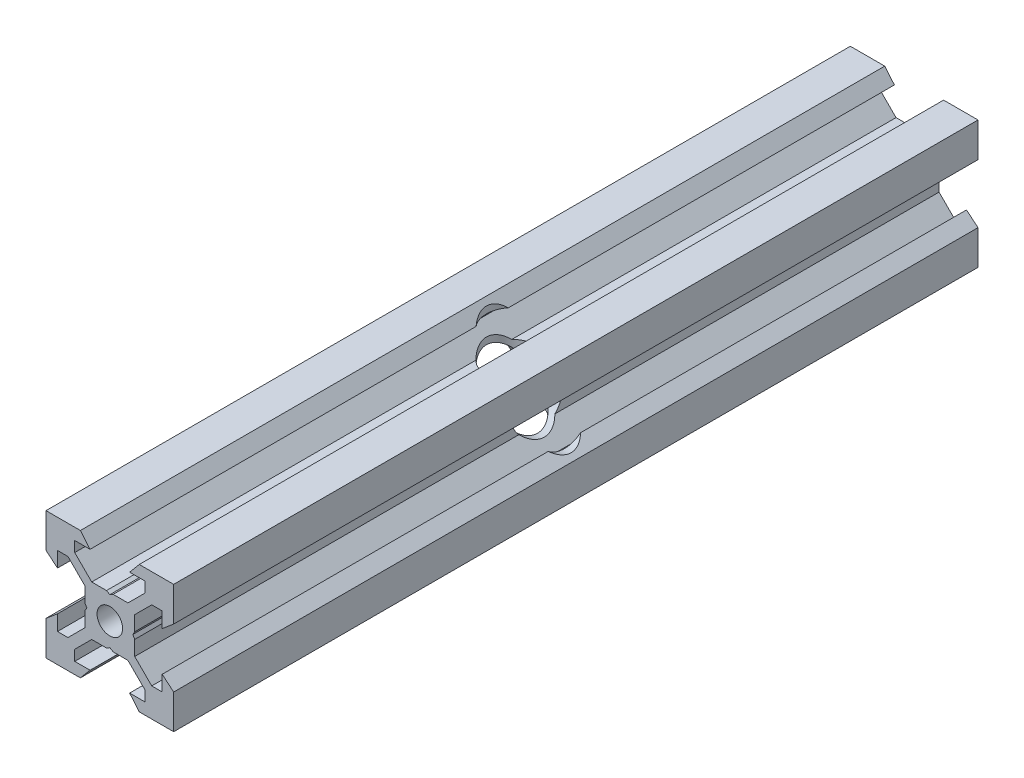
from build123d import *

# Parameters (mm, degrees)
SKETCH1_R               = 2
BOSS_EXTRUDE1_DEPTH     = 126
CUT_EXTRUDE1_DEPTH      = 127.791166885
CUT_EXTRUDE1_DEPTH_BACK = 127.791166885
SKETCH4_R               = 4
CUT_EXTRUDE2_DEPTH      = 127.791166984
CUT_EXTRUDE2_DEPTH_BACK = 127.791166984
SKETCH5_R               = 4


with BuildPart() as part:
    # Sketch1 → Boss-Extrude1 (new body)
    with BuildSketch(Plane.XY):
        Polygon((10, 10), (10, 4.610379336), (8.2, 3.1), (8.2, 5.5), (6.560660172, 5.5), (3.9, 2.839339828), (3.9, 0.519615242), (3.6, 0), (3.9, -0.519615242), (3.9, -2.839339828), (6.560660172, -5.5), (8.2, -5.5), (8.2, -3.1), (10, -4.610379336), (10, -10), (4.610379336, -10), (3.1, -8.2), (5.5, -8.2), (5.5, -6.560660172), (2.839339828, -3.9), (0.519615242, -3.9), (0, -3.6), (-0.519615242, -3.9), (-2.839339828, -3.9), (-5.5, -6.560660172), (-5.5, -8.2), (-3.1, -8.2), (-4.610379336, -10), (-10, -10), (-10, -4.610379336), (-8.2, -3.1), (-8.2, -5.5), (-6.560660172, -5.5), (-3.9, -2.839339828), (-3.9, -0.519615242), (-3.6, 0), (-3.9, 0.519615242), (-3.9, 2.839339828), (-6.560660172, 5.5), (-8.2, 5.5), (-8.2, 3.1), (-10, 4.610379336), (-10, 10), (-4.610379336, 10), (-3.1, 8.2), (-5.5, 8.2), (-5.5, 6.560660172), (-2.839339828, 3.9), (-0.519615242, 3.9), (0, 3.6), (0.519615242, 3.9), (2.839339828, 3.9), (5.5, 6.560660172), (5.5, 8.2), (3.1, 8.2), (4.610379336, 10), align=None)
        Circle(SKETCH1_R, mode=Mode.SUBTRACT)
    extrude(amount=BOSS_EXTRUDE1_DEPTH)

    # Sketch4 → Cut-Extrude1 (cut, two sides: drawn at the far end of the back side and taken through both)
    with BuildSketch(Plane(origin=(0, 0, 0), x_dir=(0, 0, -1), z_dir=(1, 0, 0)).offset(-CUT_EXTRUDE1_DEPTH_BACK)):
        with Locations((-63, 0)):
            Circle(SKETCH4_R)
    extrude(amount=CUT_EXTRUDE1_DEPTH + CUT_EXTRUDE1_DEPTH_BACK, mode=Mode.SUBTRACT)

    # Sketch5 → Cut-Extrude2 (cut, two sides: drawn at the far end of the back side and taken through both)
    with BuildSketch(Plane(origin=(0, 0, 0), x_dir=(1, 0, 0), z_dir=(0, 1, 0)).offset(-CUT_EXTRUDE2_DEPTH_BACK)):
        with Locations(Location((0, -63, 0), (0, 0, 270))):
            Circle(SKETCH5_R)
    extrude(amount=CUT_EXTRUDE2_DEPTH + CUT_EXTRUDE2_DEPTH_BACK, mode=Mode.SUBTRACT)


solid = part.part
